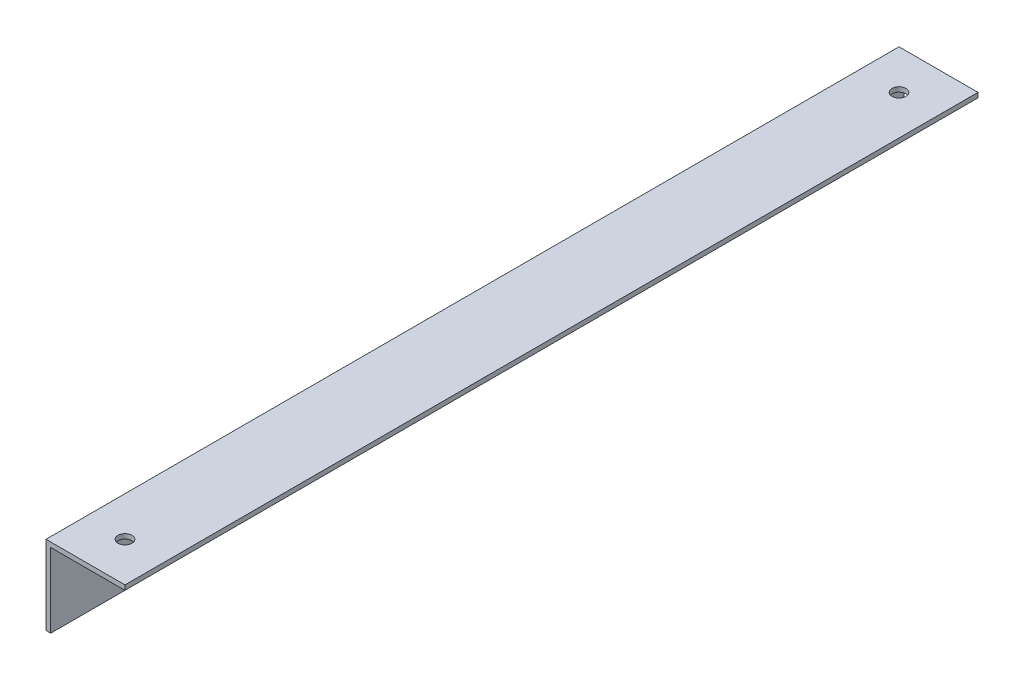
from build123d import *

# Parameters (mm, degrees)
EXTRUDE_1_DEPTH     = 270
CUT_EXTRUDE_1_REACH = 274.305
SKETCH_2_R          = 2.2


with BuildPart() as part:
    # Эскиз1 → Бобышка-Вытянуть1 (new body)
    with BuildSketch(Plane.XY):
        Polygon((0, 0), (0, -25), (1.5, -25), (1.5, -1.5), (25, -1.5), (25, 0), align=None)
    extrude(amount=EXTRUDE_1_DEPTH)

    # Эскиз2 → Вырез-Вытянуть1 (cut, up to next)
    with BuildSketch(Plane(origin=(0, 0, 0), x_dir=(1, 0, 0), z_dir=(0, 1, 0)), mode=Mode.PRIVATE) as cut_extrude_1_sk1:
        with Locations(Location((12.5, -257.5, 0), (0, 0, 270))):
            Circle(SKETCH_2_R)
    cut_extrude_1_tool1 = extrude(cut_extrude_1_sk1.sketch, amount=-CUT_EXTRUDE_1_REACH, mode=Mode.PRIVATE) & part.part
    # Эскиз2 → Вырез-Вытянуть1 (cut, up to next)
    with BuildSketch(Plane(origin=(0, 0, 0), x_dir=(1, 0, 0), z_dir=(0, 1, 0)), mode=Mode.PRIVATE) as cut_extrude_1_sk2:
        with Locations(Location((12.5, -12.5, 0), (0, 0, 270))):
            Circle(SKETCH_2_R)
    cut_extrude_1_tool2 = extrude(cut_extrude_1_sk2.sketch, amount=-CUT_EXTRUDE_1_REACH, mode=Mode.PRIVATE) & part.part
    add(cut_extrude_1_tool1.solids().sort_by_distance((12.5, 0, 257.5))[0], mode=Mode.SUBTRACT)
    add(cut_extrude_1_tool2.solids().sort_by_distance((12.5, 0, 12.5))[0], mode=Mode.SUBTRACT)


solid = part.part
